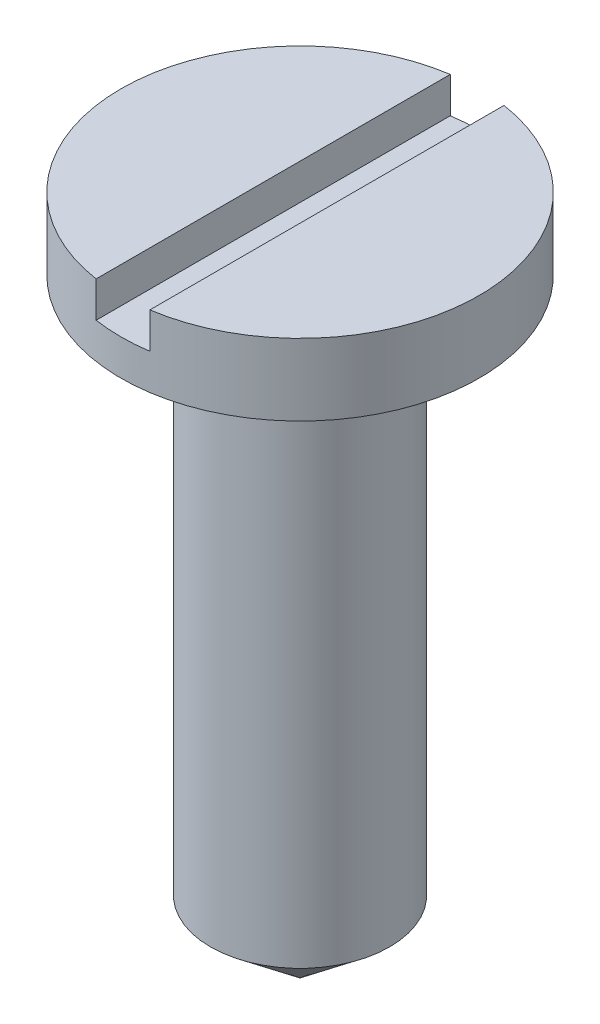
from build123d import *

# Parameters (mm, degrees)
CUT_EXTRUDE1_DEPTH      = 20.241881405
CUT_EXTRUDE1_DEPTH_BACK = 20.241881405
SKETCH2_W               = 1.5
SKETCH2_H               = 1


with BuildPart() as part:
    # Sketch1 → Revolve1 (revolve)
    with BuildSketch(Plane.XY, mode=Mode.PRIVATE) as revolve1_sk:
        Polygon((0, 0), (0, 15), (2.5, 15), (2.5, 17), (-2.5, 17), (-2.5, 0), align=None)
    revolve(revolve1_sk.sketch.rotate(Axis((-2.5, 17, 0), (0, -1, 0)), 180), axis=Axis((-2.5, 17, 0), (0, -1, 0)))

    # Sketch2 → Cut-Extrude1 (cut, two sides: drawn at the far end of the back side and taken through both)
    with BuildSketch(Plane.XY.offset(-CUT_EXTRUDE1_DEPTH_BACK)):
        with Locations((-2.5, 16.5)):
            Rectangle(SKETCH2_W, SKETCH2_H)
    extrude(amount=CUT_EXTRUDE1_DEPTH + CUT_EXTRUDE1_DEPTH_BACK, mode=Mode.SUBTRACT)

    # Sketch3 → Revolve2 (revolve)
    with BuildSketch(Plane.XY, mode=Mode.PRIVATE) as revolve2_sk:
        Polygon((-2.5, 0), (-2.5, -2), (0, 0), align=None)
    revolve(revolve2_sk.sketch.rotate(Axis((-2.5, 0, 0), (0, -1, 0)), 90), axis=Axis((-2.5, 0, 0), (0, -1, 0)))


solid = part.part
